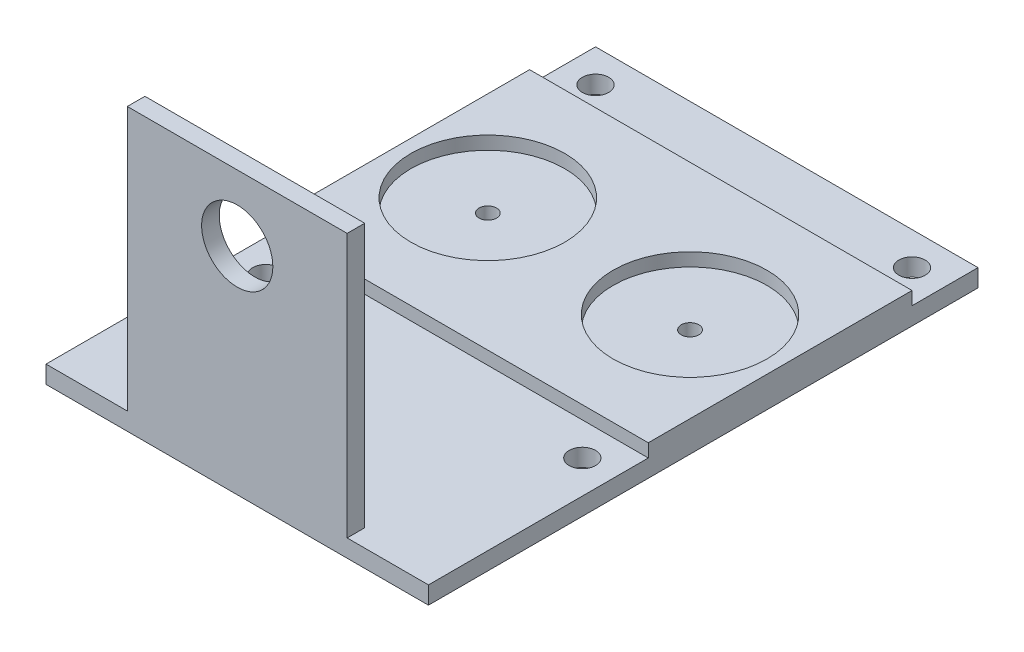
from build123d import *

# Parameters (mm, degrees)
SKETCH_1_W          = 87
SKETCH_1_H          = 90
SKETCH_1_R          = 3
SKETCH_1_H_2        = 35
EXTRUDE_1_DEPTH     = 4
SKETCH_3_W          = 87
SKETCH_3_H          = 60
SKETCH_3_R          = 17.5
EXTRUDE_2_DEPTH     = 3
SKETCH_4_R          = 2
CUT_EXTRUDE_1_DEPTH = 92.149602303
SKETCH_5_W          = 50
SKETCH_5_H          = 60
SKETCH_5_R          = 8.1
EXTRUDE_3_DEPTH     = 4


with BuildPart() as part:
    # 草图1 → 凸台-拉伸1 (new body)
    # profile 1 of 2: a face of its own
    with BuildSketch(Plane(origin=(0, 0, 0), x_dir=(1, 0, 0), z_dir=(0, 1, 0))):
        Rectangle(SKETCH_1_W, SKETCH_1_H)
        with Locations(Location((36, 37.5, 0), (0, 0, 270))):
            Circle(SKETCH_1_R, mode=Mode.SUBTRACT)
        with Locations(Location((-36, 37.5, 0), (0, 0, 270))):
            Circle(SKETCH_1_R, mode=Mode.SUBTRACT)
        with Locations(Location((36, -37.5, 0), (0, 0, 270))):
            Circle(SKETCH_1_R, mode=Mode.SUBTRACT)
        with Locations(Location((-36, -37.5, 0), (0, 0, 270))):
            Circle(SKETCH_1_R, mode=Mode.SUBTRACT)
    # profile 2 of 2: a face of its own
    with BuildSketch(Plane(origin=(0, 0, 0), x_dir=(1, 0, 0), z_dir=(0, 1, 0))):
        with Locations((0, -62.5)):
            Rectangle(SKETCH_1_W, SKETCH_1_H_2)
    extrude(amount=EXTRUDE_1_DEPTH)

    # 草图3 → 凸台-拉伸2 (add)
    with BuildSketch(Plane(origin=(0, 4, 0), x_dir=(1, 0, 0), z_dir=(0, 1, 0))):
        Rectangle(SKETCH_3_W, SKETCH_3_H)
        with Locations(Location((-23, 0, 0), (0, 0, 270))):
            Circle(SKETCH_3_R, mode=Mode.SUBTRACT)
        with Locations(Location((23, 0, 0), (0, 0, 270))):
            Circle(SKETCH_3_R, mode=Mode.SUBTRACT)
    extrude(amount=EXTRUDE_2_DEPTH)

    # 草图4 → 切除-拉伸1 (cut, through all)
    with BuildSketch(Plane(origin=(0, 4, 0), x_dir=(1, 0, 0), z_dir=(0, 1, 0))):
        with Locations(Location((23, 0, 0), (0, 0, 270))):
            Circle(SKETCH_4_R)
        with Locations(Location((-23, 0, 0), (0, 0, 270))):
            Circle(SKETCH_4_R)
    extrude(amount=-CUT_EXTRUDE_1_DEPTH, mode=Mode.SUBTRACT)

    # 草图5 → 凸台-拉伸3 (add)
    with BuildSketch(Plane.XY.offset(80)):
        with Locations((0, 34)):
            Rectangle(SKETCH_5_W, SKETCH_5_H)
        with Locations((0, 49)):
            Circle(SKETCH_5_R, mode=Mode.SUBTRACT)
    extrude(amount=-EXTRUDE_3_DEPTH)


solid = part.part
